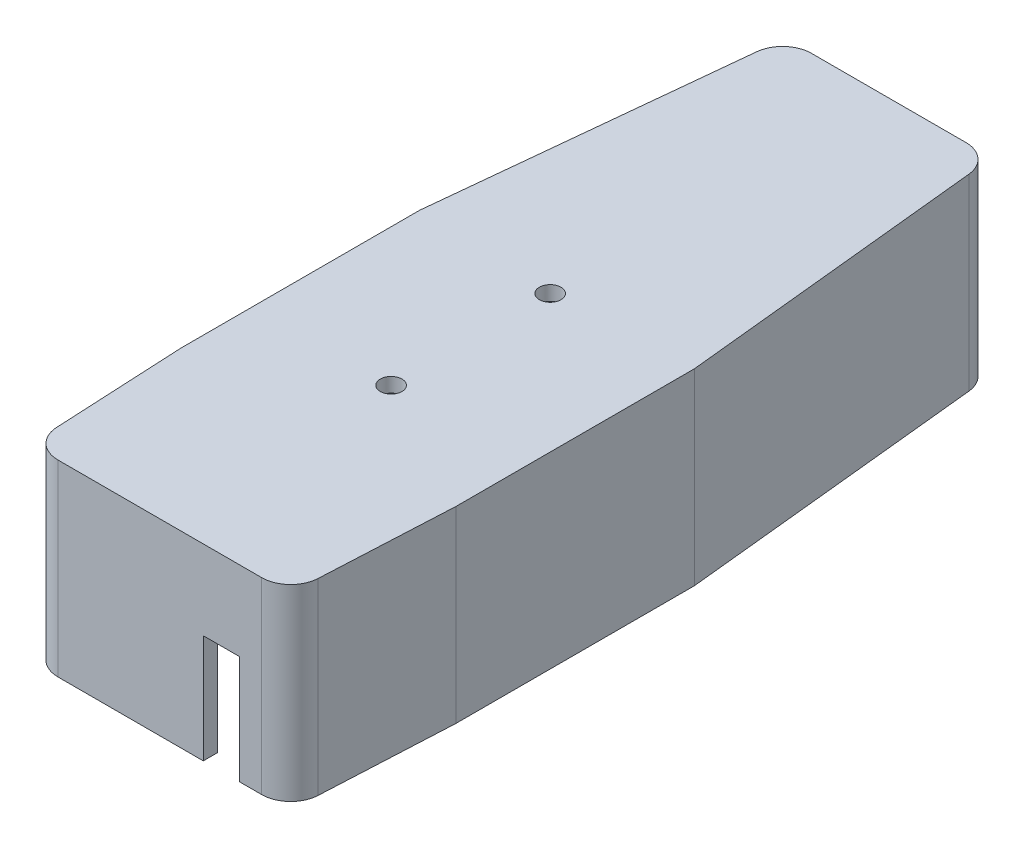
from build123d import *

# Parameters (mm, degrees)
BOSS_EXTRUDE1_DEPTH = 26
SHELL1_T            = -2
SKETCH3_W           = 5
SKETCH3_H           = 15
CUT_EXTRUDE1_DEPTH  = 5
SKETCH4_R           = 1.5
CUT_EXTRUDE2_DEPTH  = 10
BOSS_EXTRUDE2_DEPTH = 3
SKETCH7_R           = 1.397
CUT_EXTRUDE3_DEPTH  = 5
SKETCH8_R           = 1.397
CUT_EXTRUDE4_DEPTH  = 5


with BuildPart() as part:
    # Sketch1 → Boss-Extrude1 (new body)
    with BuildSketch(Plane(origin=(0, 0, 0), x_dir=(1, 0, 0), z_dir=(0, 1, 0))):
        with BuildLine():
            Line((6.305887047, 78.84802453), (27.694112953, 78.84802453))
            ThreePointArc((27.694112953, 78.84802453), (30.374796425, 77.816851929), (31.673356222, 75.254992592))
            Line((31.673356222, 75.254992592), (36, 32.950031211))
            Line((36, 32.950031211), (36, -0.049968789))
            Line((36, -0.049968789), (35.092510916, -18.199750468))
            ThreePointArc((35.092510916, -18.199750468), (33.854401824, -20.898189251), (31.097501561, -22))
            Line((31.097501561, -22), (2.902498439, -22))
            ThreePointArc((2.902498439, -22), (0.145598176, -20.898189251), (-1.092510916, -18.199750468))
            Line((-1.092510916, -18.199750468), (-2, -0.049968789))
            Line((-2, -0.049968789), (-2, 32.950031211))
            Line((-2, 32.950031211), (2.326643778, 75.254992592))
            ThreePointArc((2.326643778, 75.254992592), (3.625203575, 77.816851929), (6.305887047, 78.84802453))
        make_face()
    extrude(amount=BOSS_EXTRUDE1_DEPTH)

    # Shell1
    shell1_openings = [part.faces().sort_by_distance(p)[0] for p in [
        (17, 0, -26.610641327),
    ]]
    offset(amount=SHELL1_T, openings=shell1_openings, kind=Kind.INTERSECTION)

    # Sketch3 → Cut-Extrude1 (cut)
    with BuildSketch(Plane.XY.offset(22)):
        with Locations((25.508858148, 7.5)):
            Rectangle(SKETCH3_W, SKETCH3_H)
    extrude(amount=-CUT_EXTRUDE1_DEPTH, mode=Mode.SUBTRACT)

    # Sketch4 → Cut-Extrude2 (cut)
    with BuildSketch(Plane.XZ.offset(-24)):
        with Locations(Location((17, -10, 0), (0, 0, 270))):
            Circle(SKETCH4_R)
        with Locations(Location((17, -32, 0), (0, 0, 270))):
            Circle(SKETCH4_R)
    extrude(amount=-CUT_EXTRUDE2_DEPTH, mode=Mode.SUBTRACT)

    # Sketch5 → Boss-Extrude2 (add)
    with BuildSketch(Plane.XZ):
        with BuildLine():
            Line((30.522727273, -66.84802453), (3.477272727, -66.84802453))
            Line((3.477272727, -66.84802453), (4.316265412, -75.051508561))
            ThreePointArc((4.316265412, -75.051508561), (4.965545311, -76.332438229), (6.305887047, -76.84802453))
            Line((6.305887047, -76.84802453), (27.694112953, -76.84802453))
            ThreePointArc((27.694112953, -76.84802453), (29.034454689, -76.332438229), (29.683734588, -75.051508561))
            Line((29.683734588, -75.051508561), (30.522727273, -66.84802453))
        make_face()
    extrude(amount=-BOSS_EXTRUDE2_DEPTH)

    # Sketch7 → Cut-Extrude3 (cut)
    with BuildSketch(Plane.XZ):
        with Locations(Location((24.335511696, -71.84802453, 0), (0, 0, 270))):
            Circle(SKETCH7_R)
    extrude(amount=-CUT_EXTRUDE3_DEPTH, mode=Mode.SUBTRACT)

    # Sketch8 → Cut-Extrude4 (cut)
    with BuildSketch(Plane.XZ):
        with Locations(Location((9.336175071, -71.84802453, 0), (0, 0, 270))):
            Circle(SKETCH8_R)
    extrude(amount=-CUT_EXTRUDE4_DEPTH, mode=Mode.SUBTRACT)


solid = part.part
